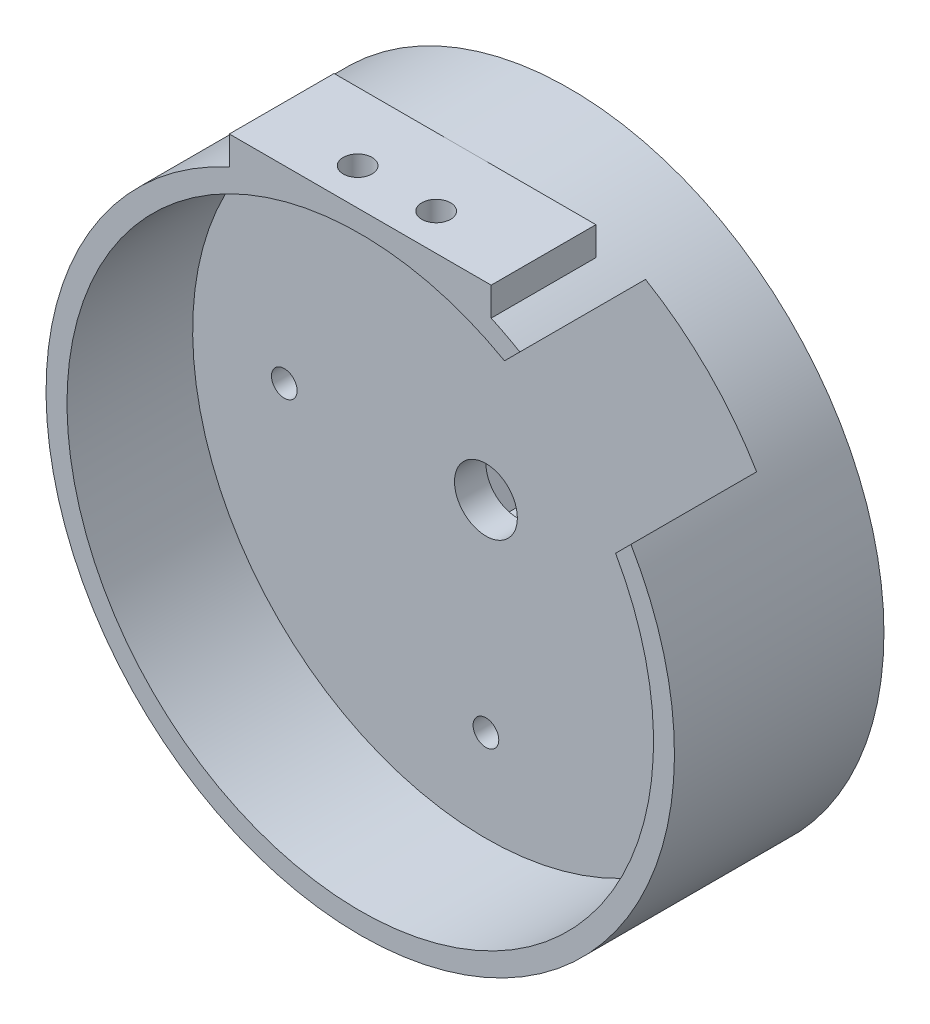
from build123d import *

# Parameters (mm, degrees)
SKETCH_1_R               = 30
EXTRUDE_1_DEPTH          = 25
EXTRUDE_2_DEPTH          = 10
EXTRUDE_3_DEPTH          = 10
CUT_EXTRUDE_1_DEPTH      = 10
SKETCH_5_R               = 1.375
CUT_EXTRUDE_2_DEPTH      = 3
SKETCH_7_R               = 28
CUT_EXTRUDE_4_DEPTH      = 17
SKETCH_8_R               = 1.225
CUT_EXTRUDE_5_DEPTH      = 22
SKETCH_10_R              = 3
CUT_EXTRUDE_6_DEPTH      = 50.244289121
CUT_EXTRUDE_START        = -17
CUT_EXTRUDE_8_DEPTH      = 17
CUT_EXTRUDE_START_2      = -5
SKETCH_14_R              = 30
CUT_EXTRUDE_9_DEPTH      = 5
SKETCH_11_R              = 2.25
CUT_EXTRUDE_10_DEPTH     = 2.5
PATTERN_CIRCULAR_1_COUNT = 4
CUT_EXTRUDE_11_DEPTH     = 5


with BuildPart() as part:
    # 草图1 → 凸台-拉伸1 (new body)
    with BuildSketch(Plane.XY):
        Circle(SKETCH_1_R)
    extrude(amount=EXTRUDE_1_DEPTH)

    # 草图2 → 凸台-拉伸2 (add)
    with BuildSketch(Plane(origin=(0, 0, 0), x_dir=(-1, 0, 0), z_dir=(0, 0, -1))):
        with BuildLine():
            Line((0, 30), (-12.5, 30))
            Line((-12.5, 30), (-12.5, 27.271780287))
            ThreePointArc((-12.5, 27.271780287), (-6.397131834, 29.310010309), (0, 30))
        make_face()
        with BuildLine():
            Line((12.5, 30), (0, 30))
            ThreePointArc((0, 30), (6.397131834, 29.310010309), (12.5, 27.271780287))
            Line((12.5, 27.271780287), (12.5, 30))
        make_face()
    extrude(amount=-EXTRUDE_2_DEPTH)

    # 草图3 → 凸台-拉伸3 (add)
    with BuildSketch(Plane.XY.offset(10)):
        with BuildLine():
            Line((-12.5, 30), (-12.5, 27.271780287))
            ThreePointArc((-12.5, 27.271780287), (-6.397131834, 29.310010309), (0, 30))
            Line((0, 30), (-12.5, 30))
        make_face()
        with BuildLine():
            ThreePointArc((0, 30), (6.397131834, 29.310010309), (12.5, 27.271780287))
            Line((12.5, 27.271780287), (12.5, 30))
            Line((12.5, 30), (0, 30))
        make_face()
    extrude(amount=EXTRUDE_3_DEPTH)

    # 草图4 → 切除-拉伸1 (cut)
    with BuildSketch(Plane(origin=(0, 0, 0), x_dir=(-1, 0, 0), z_dir=(0, 0, -1))):
        with BuildLine():
            Line((-12.5, 30), (-12.5, 27.271780287))
            ThreePointArc((-12.5, 27.271780287), (-6.397131834, 29.310010309), (0, 30))
            Line((0, 30), (-12.5, 30))
        make_face()
        with BuildLine():
            ThreePointArc((0, 30), (6.397131834, 29.310010309), (12.5, 27.271780287))
            Line((12.5, 27.271780287), (12.5, 30))
            Line((12.5, 30), (0, 30))
        make_face()
    extrude(amount=-CUT_EXTRUDE_1_DEPTH, mode=Mode.SUBTRACT)

    # 草图5 → 切除-拉伸2 (cut)
    with BuildSketch(Plane(origin=(0, 30, 0), x_dir=(1, 0, 0), z_dir=(0, 1, 0))):
        with Locations((-3.75, -16.5)):
            Circle(SKETCH_5_R)
        with Locations((3.75, -16.5)):
            Circle(SKETCH_5_R)
    extrude(amount=-CUT_EXTRUDE_2_DEPTH, mode=Mode.SUBTRACT)

    # 草图7 → 切除-拉伸4 (cut)
    with BuildSketch(Plane.XY.offset(25)):
        Circle(SKETCH_7_R)
    extrude(amount=-CUT_EXTRUDE_4_DEPTH, mode=Mode.SUBTRACT)

    # 草图8 → 切除-拉伸5 (cut)
    with BuildSketch(Plane(origin=(0, 0, 0), x_dir=(-1, 0, 0), z_dir=(0, 0, -1))):
        with Locations((0, 19.25)):
            Circle(SKETCH_8_R)
        with Locations((19.25, 0)):
            Circle(SKETCH_8_R)
        with Locations((0, -19.25)):
            Circle(SKETCH_8_R)
        with Locations((-19.25, 0)):
            Circle(SKETCH_8_R)
    extrude(amount=-CUT_EXTRUDE_5_DEPTH, mode=Mode.SUBTRACT)

    # 草图10 → 切除-拉伸6 (cut, through all)
    with BuildSketch(Plane(origin=(0, 0, 0), x_dir=(-1, 0, 0), z_dir=(0, 0, -1))):
        Circle(SKETCH_10_R)
    extrude(amount=-CUT_EXTRUDE_6_DEPTH, mode=Mode.SUBTRACT)

    # 草图13 → 切除-拉伸8 (cut)
    with BuildSketch(Plane.XY.offset(25).offset(CUT_EXTRUDE_START)):
        with BuildLine():
            Line((14.928300859, 4.321699141), (25.842896765, 15.236295048))
            ThreePointArc((25.842896765, 15.236295048), (21.213203436, 21.213203436), (15.236295048, 25.842896765))
            Line((15.236295048, 25.842896765), (4.321699141, 14.928300859))
            Line((4.321699141, 14.928300859), (14.928300859, 4.321699141))
        make_face()
    extrude(amount=CUT_EXTRUDE_8_DEPTH, mode=Mode.SUBTRACT)

    # 草图14 → 切除-拉伸9 (cut)
    with BuildSketch(Plane.XY.offset(25).offset(CUT_EXTRUDE_START_2)):
        Circle(SKETCH_14_R)
    extrude(amount=CUT_EXTRUDE_9_DEPTH, mode=Mode.SUBTRACT)

    # 草图11 → 切除-拉伸10 (cut)
    with BuildSketch(Plane(origin=(0, 0, 0), x_dir=(-1, 0, 0), z_dir=(0, 0, -1))):
        with Locations((0, 19.25)):
            Circle(SKETCH_11_R)
    cut_extrude_10 = extrude(amount=-CUT_EXTRUDE_10_DEPTH, mode=Mode.SUBTRACT)

    # 阵列(圆周)1: 切除-拉伸10 ×4 about axis
    pattern_circular_1_axis = Axis((0, 0, 0), (0, 0, -1))
    for i in range(1, PATTERN_CIRCULAR_1_COUNT):
        add(cut_extrude_10.rotate(pattern_circular_1_axis, i * 360 / PATTERN_CIRCULAR_1_COUNT), mode=Mode.SUBTRACT)

    # 草图17 → 切除-拉伸11 (cut)
    with BuildSketch(Plane(origin=(0, 0, 0), x_dir=(-1, 0, 0), z_dir=(0, 0, -1))):
        Polygon((5.77, 0), (2.885, 4.99696658), (-2.885, 4.99696658), (-5.77, 0), (-2.885, -4.99696658), (2.885, -4.99696658), align=None)
    extrude(amount=-CUT_EXTRUDE_11_DEPTH, mode=Mode.SUBTRACT)


solid = part.part
